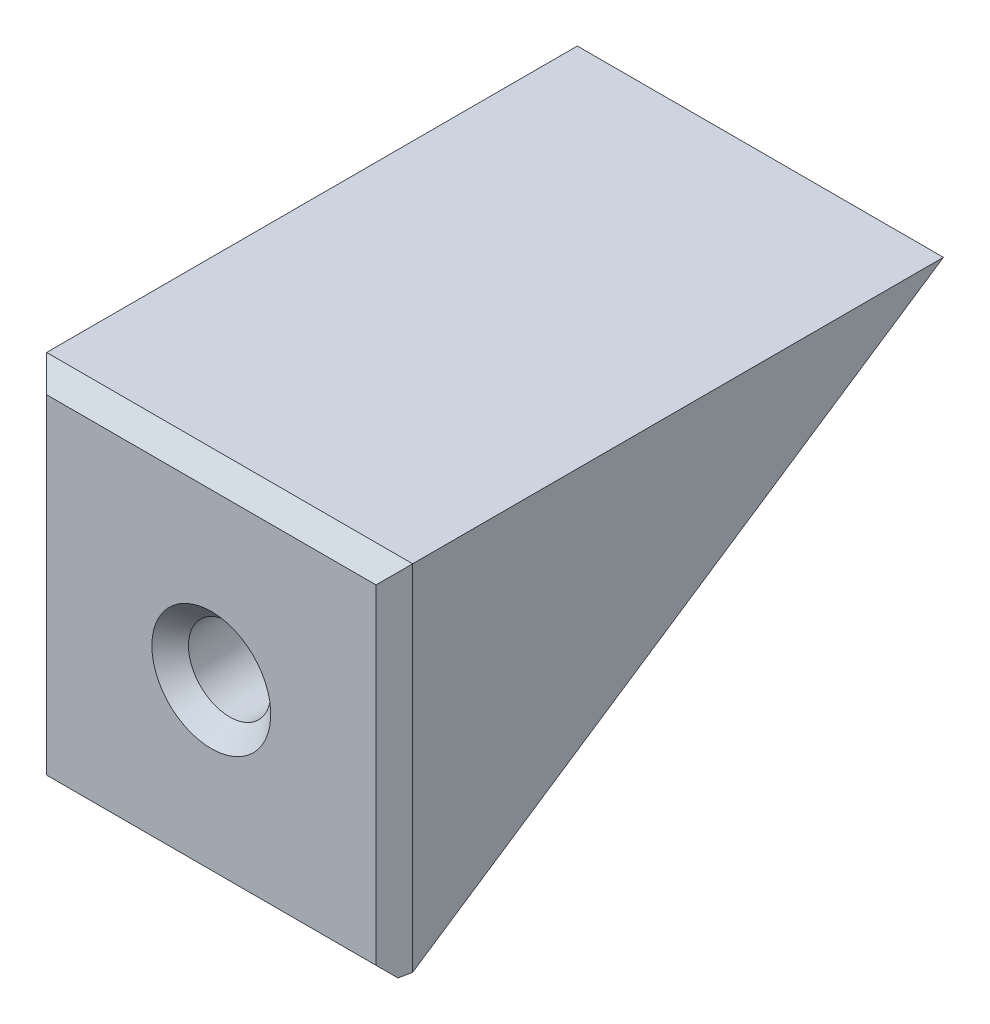
from build123d import *
from OCP.BRepFilletAPI import BRepFilletAPI_MakeChamfer

# Parameters (mm, degrees)
BOSS_EXTRUDE1_DEPTH                            = 10
BOSS_EXTRUDE2_REACH                            = 30.089
SKETCH2_R                                      = 5.5
CUT_EXTRUDE1_START                             = 20
SKETCH3_R                                      = 5.5
CUT_EXTRUDE1_DEPTH                             = 20
CSK_FOR_8_FLAT_HEAD_MACHINE_SCREW1_D           = 4.4958
CSK_FOR_8_FLAT_HEAD_MACHINE_SCREW1_CSINK_D     = 8.4328
CSK_FOR_8_FLAT_HEAD_MACHINE_SCREW1_CSINK_ANGLE = 82
CHAMFER1_SIZE                                  = 1
CHAMFER1_SIZE2                                 = 0.721110255


with BuildPart() as part:
    # Sketch1 → Boss-Extrude1 (new, symmetric)
    with BuildSketch(Plane(origin=(0, 0, 0), x_dir=(0, 0, -1), z_dir=(1, 0, 0))):
        Polygon((0, 0), (30, 0), (0, -20), align=None)
    extrude(amount=BOSS_EXTRUDE1_DEPTH, both=True)

    # Sketch2 → Boss-Extrude2 (add, up to next)
    with BuildSketch(Plane.XY.offset(-17), mode=Mode.PRIVATE) as boss_extrude2_sk1:
        with Locations((0, -10)):
            Circle(SKETCH2_R)
    boss_extrude2_tool1 = extrude(boss_extrude2_sk1.sketch, amount=BOSS_EXTRUDE2_REACH, mode=Mode.PRIVATE) - part.part
    add(boss_extrude2_tool1.solids().sort_by_distance((0, -10, -17))[0])

    # Sketch3 → Cut-Extrude1 (cut)
    with BuildSketch(Plane(origin=(0, 0, -17), x_dir=(-1, 0, 0), z_dir=(0, 0, -1)).offset(CUT_EXTRUDE1_START)):
        with Locations((0, -10)):
            Circle(SKETCH3_R)
    extrude(amount=-CUT_EXTRUDE1_DEPTH, mode=Mode.SUBTRACT)

    # CSK for #8 Flat Head Machine Screw1 (through all)
    with Locations(Plane(origin=(0, 0, -17), x_dir=(-1, 0, 0), z_dir=(0, 0, -1))):
        with Locations((0, -10)):
            CounterSinkHole(CSK_FOR_8_FLAT_HEAD_MACHINE_SCREW1_D / 2, CSK_FOR_8_FLAT_HEAD_MACHINE_SCREW1_CSINK_D / 2, counter_sink_angle=CSK_FOR_8_FLAT_HEAD_MACHINE_SCREW1_CSINK_ANGLE)

    # Chamfer1: one chamfer whose edges measure the first distance from different faces: ONE call of the kernel's chamfer builder (chamfer() names one face for all edges)
    chamfer1_edges_1 = [part.edges().sort_by_distance(p)[0] for p in [
        (-2.2479, -10, 0),
        (-10, -10, 0),
        (10, -10, 0),
        (0, 0, 0),
    ]]
    chamfer1_edges_2 = [part.edges().sort_by_distance(p)[0] for p in [
        (0, -20, 0),
    ]]
    chamfer1_side_2 = [part.faces().sort_by_distance(p)[0] for p in [
        (0, -19.717157288, 0),
    ]]
    chamfer1 = BRepFilletAPI_MakeChamfer(part.part.solid().wrapped)
    for e in chamfer1_edges_1:
        chamfer1.Add(CHAMFER1_SIZE, e.wrapped)
    for e in chamfer1_edges_2:
        chamfer1.Add(CHAMFER1_SIZE, CHAMFER1_SIZE2, e.wrapped, chamfer1_side_2[0].wrapped)  # the first distance lies on this face
    add(Compound.cast(chamfer1.Shape()), mode=Mode.REPLACE)


solid = part.part
